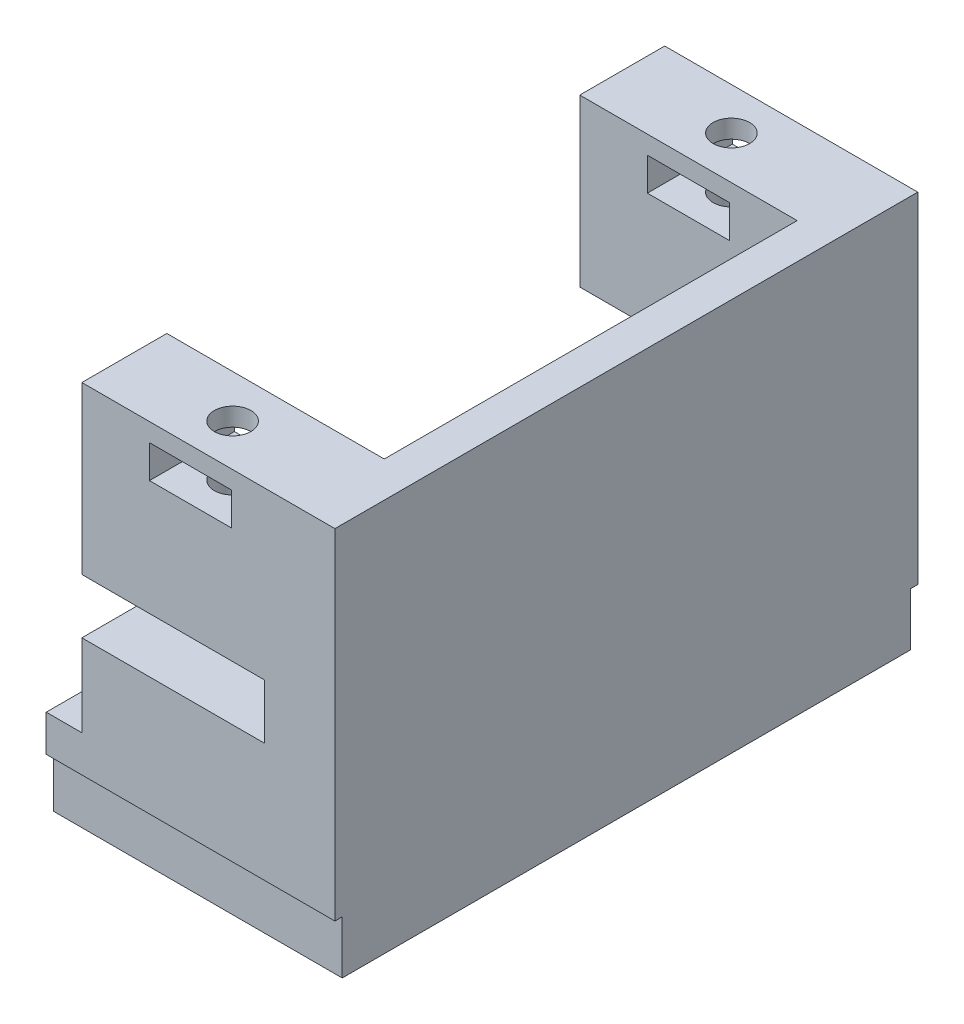
from build123d import *

# Parameters (mm, degrees)
SKETCH1_W           = 15.8
SKETCH1_H           = 31.9
BOSS_EXTRUDE1_DEPTH = 2
SKETCH2_W           = 15.8
SKETCH2_H           = 31.9
SKETCH2_W_2         = 11.9
SKETCH2_H_2         = 22.6
BOSS_EXTRUDE3_DEPTH = 16.6
SKETCH3_R           = 1
CUT_EXTRUDE1_DEPTH  = 10
SKETCH4_W           = 4.5
SKETCH4_H           = 1.8
CUT_EXTRUDE2_DEPTH  = 38.762150362
SKETCH5_W           = 1.95
SKETCH5_H           = 31.9
CUT_EXTRUDE3_DEPTH  = 16.6
SKETCH6_W           = 4.65
SKETCH6_H           = 3
CUT_EXTRUDE4_DEPTH  = 10
BOSS_EXTRUDE4_DEPTH = 2.9


with BuildPart() as part:
    # Sketch1 → Boss-Extrude1 (new body)
    with BuildSketch(Plane(origin=(0, 0, 0), x_dir=(1, 0, 0), z_dir=(0, 1, 0))):
        Rectangle(SKETCH1_W, SKETCH1_H)
    extrude(amount=BOSS_EXTRUDE1_DEPTH)

    # Sketch2 → Boss-Extrude3 (add)
    with BuildSketch(Plane(origin=(0, 2, 0), x_dir=(1, 0, 0), z_dir=(0, 1, 0))):
        Rectangle(SKETCH2_W, SKETCH2_H)
        Rectangle(SKETCH2_W_2, SKETCH2_H_2, mode=Mode.SUBTRACT)
    extrude(amount=BOSS_EXTRUDE3_DEPTH)

    # Sketch3 → Cut-Extrude1 (cut)
    with BuildSketch(Plane(origin=(0, 18.6, 0), x_dir=(1, 0, 0), z_dir=(0, 1, 0))):
        with Locations(Location((0, 13.65, 0), (0, 0, 270))):
            Circle(SKETCH3_R)
        with Locations(Location((0, -13.65, 0), (0, 0, 90))):
            Circle(SKETCH3_R)
    extrude(amount=-CUT_EXTRUDE1_DEPTH, mode=Mode.SUBTRACT)

    # Sketch4 → Cut-Extrude2 (cut, through all)
    with BuildSketch(Plane.XY.offset(15.95)):
        with Locations((0, 16.7)):
            Rectangle(SKETCH4_W, SKETCH4_H)
    extrude(amount=-CUT_EXTRUDE2_DEPTH, mode=Mode.SUBTRACT)

    # Sketch5 → Cut-Extrude3 (cut)
    with BuildSketch(Plane(origin=(0, 18.6, 0), x_dir=(1, 0, 0), z_dir=(0, 1, 0))):
        with Locations((-6.925, 0)):
            Rectangle(SKETCH5_W, SKETCH5_H)
    extrude(amount=-CUT_EXTRUDE3_DEPTH, mode=Mode.SUBTRACT)

    # Sketch6 → Cut-Extrude4 (cut)
    with BuildSketch(Plane.ZY.offset(5.95)):
        with Locations((13.625, 8)):
            Rectangle(SKETCH6_W, SKETCH6_H)
    cut_extrude4 = extrude(amount=-CUT_EXTRUDE4_DEPTH, mode=Mode.SUBTRACT)

    # Sketch7 → Boss-Extrude4 (add)
    with BuildSketch(Plane.XZ):
        Polygon((7.9, 15.55), (-7.9, 15.55), (-7.9, 12.55), (5.9, 12.55), (5.9, -12.55), (-7.9, -12.55), (-7.9, -15.55), (7.9, -15.55), align=None)
    extrude(amount=BOSS_EXTRUDE4_DEPTH)

    # Mirror1: Cut-Extrude4 across plane
    add(cut_extrude4.mirror(Plane.XY), mode=Mode.SUBTRACT)


solid = part.part
